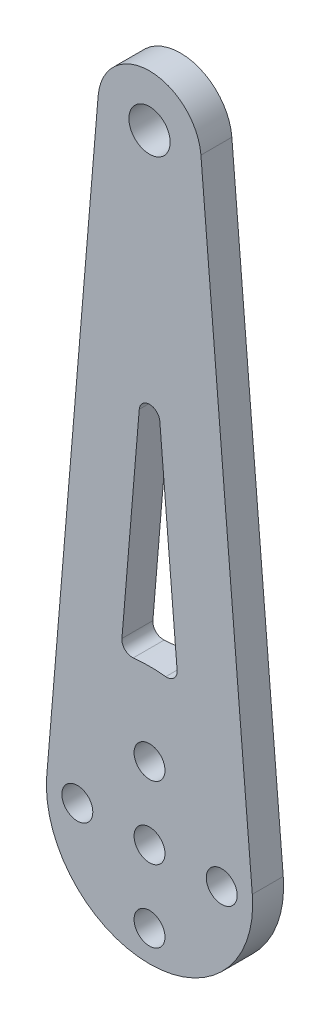
from build123d import *

# Parameters (mm, degrees)
SKETCH_2_R          = 1.5
SKETCH_2_R_2        = 2
EXTRUDE_1_DEPTH     = 3
CUT_EXTRUDE_1_DEPTH = 66.833122363


with BuildPart() as part:
    # 草图2 → 凸台-拉伸1 (new body)
    with BuildSketch(Plane.XY):
        with BuildLine():
            Line((-9.965217286, 0.833333333), (-4.982608643, 60.416666667))
            ThreePointArc((-4.982608643, 60.416666667), (0, 65), (4.982608643, 60.416666667))
            Line((4.982608643, 60.416666667), (9.965217286, 0.833333333))
            ThreePointArc((9.965217286, 0.833333333), (0, -10), (-9.965217286, 0.833333333))
        make_face()
        Circle(SKETCH_2_R, mode=Mode.SUBTRACT)
        with Locations((0, 7)):
            Circle(SKETCH_2_R, mode=Mode.SUBTRACT)
        with Locations((7, 0)):
            Circle(SKETCH_2_R, mode=Mode.SUBTRACT)
        with Locations((0, -7)):
            Circle(SKETCH_2_R, mode=Mode.SUBTRACT)
        with Locations((-7, 0)):
            Circle(SKETCH_2_R, mode=Mode.SUBTRACT)
        with Locations((0, 60)):
            Circle(SKETCH_2_R_2, mode=Mode.SUBTRACT)
    extrude(amount=EXTRUDE_1_DEPTH)

    # 草图3 → 切除-拉伸1 (cut, through all)
    with BuildSketch(Plane.XY.offset(3)):
        with BuildLine():
            Line((2.676400777, 15.994901653), (0.996521729, 36.083333333))
            ThreePointArc((0.996521729, 36.083333333), (0, 37), (-0.996521729, 36.083333333))
            Line((-0.996521729, 36.083333333), (-2.676400777, 15.994901653))
            ThreePointArc((-2.676400777, 15.994901653), (-2.379252162, 15.196811544), (-1.574886608, 14.917095299))
            ThreePointArc((-1.574886608, 14.917095299), (0, 15), (1.574886608, 14.917095299))
            ThreePointArc((1.574886608, 14.917095299), (2.379252162, 15.196811544), (2.676400777, 15.994901653))
        make_face()
    extrude(amount=-CUT_EXTRUDE_1_DEPTH, mode=Mode.SUBTRACT)


solid = part.part
